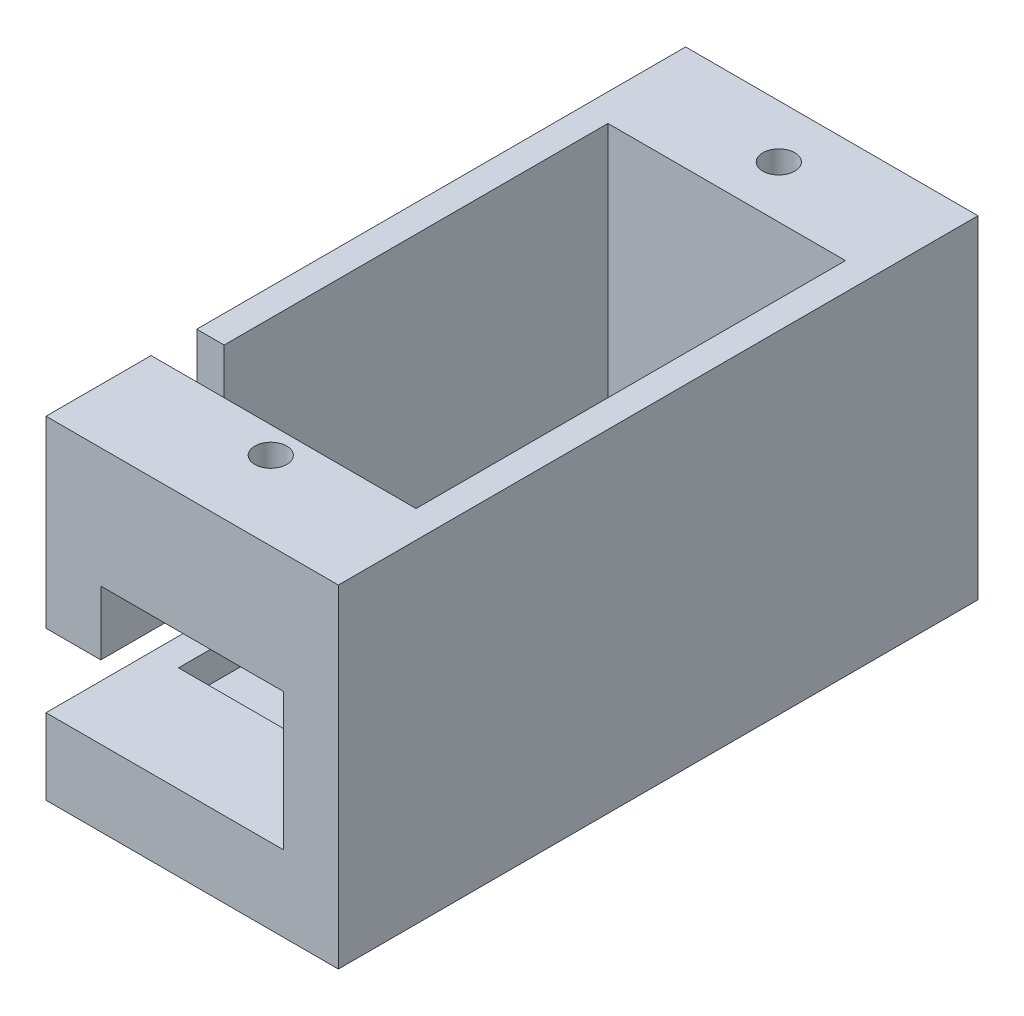
from build123d import *

# Parameters (mm, degrees)
SKETCH1_W           = 16
SKETCH1_H           = 35
BOSS_EXTRUDE1_DEPTH = 18.2
SKETCH2_W           = 13
SKETCH2_H           = 23.5
CUT_EXTRUDE1_DEPTH  = 15.7
SKETCH3_R           = 0.875
CUT_EXTRUDE2_DEPTH  = 5
SKETCH4_W           = 10
SKETCH4_H           = 7.5
CUT_EXTRUDE3_DEPTH  = 5.75
SKETCH5_W           = 2.5
SKETCH5_H           = 12.5
CUT_EXTRUDE4_DEPTH  = 1.5
SKETCH6_W           = 8.25
SKETCH6_H           = 4
CUT_EXTRUDE5_DEPTH  = 3


with BuildPart() as part:
    # Sketch1 → Boss-Extrude1 (new body)
    with BuildSketch(Plane(origin=(0, 0, 0), x_dir=(1, 0, 0), z_dir=(0, 1, 0))):
        Rectangle(SKETCH1_W, SKETCH1_H)
    extrude(amount=BOSS_EXTRUDE1_DEPTH)

    # Sketch2 → Cut-Extrude1 (cut)
    with BuildSketch(Plane(origin=(0, 18.2, 0), x_dir=(1, 0, 0), z_dir=(0, 1, 0))):
        Rectangle(SKETCH2_W, SKETCH2_H)
    extrude(amount=-CUT_EXTRUDE1_DEPTH, mode=Mode.SUBTRACT)

    # Sketch3 → Cut-Extrude2 (cut)
    with BuildSketch(Plane(origin=(0, 18.2, 0), x_dir=(1, 0, 0), z_dir=(0, 1, 0))):
        with Locations(Location((0, -13.2, 0), (0, 0, 270))):
            Circle(SKETCH3_R)
        with Locations(Location((0, 14.6, 0), (0, 0, 270))):
            Circle(SKETCH3_R)
    extrude(amount=-CUT_EXTRUDE2_DEPTH, mode=Mode.SUBTRACT)

    # Sketch4 → Cut-Extrude3 (cut)
    with BuildSketch(Plane(origin=(0, 0, 11.75), x_dir=(-1, 0, 0), z_dir=(0, 0, -1))):
        with Locations((0, 7.9)):
            Rectangle(SKETCH4_W, SKETCH4_H)
    extrude(amount=-CUT_EXTRUDE3_DEPTH, mode=Mode.SUBTRACT)

    # Sketch5 → Cut-Extrude4 (cut)
    with BuildSketch(Plane.ZY.offset(8)):
        with Locations((10.5, 11.95)):
            Rectangle(SKETCH5_W, SKETCH5_H)
    extrude(amount=-CUT_EXTRUDE4_DEPTH, mode=Mode.SUBTRACT)

    # Sketch6 → Cut-Extrude5 (cut)
    with BuildSketch(Plane.ZY.offset(8)):
        with Locations((13.375, 6.15)):
            Rectangle(SKETCH6_W, SKETCH6_H)
    extrude(amount=-CUT_EXTRUDE5_DEPTH, mode=Mode.SUBTRACT)


solid = part.part
